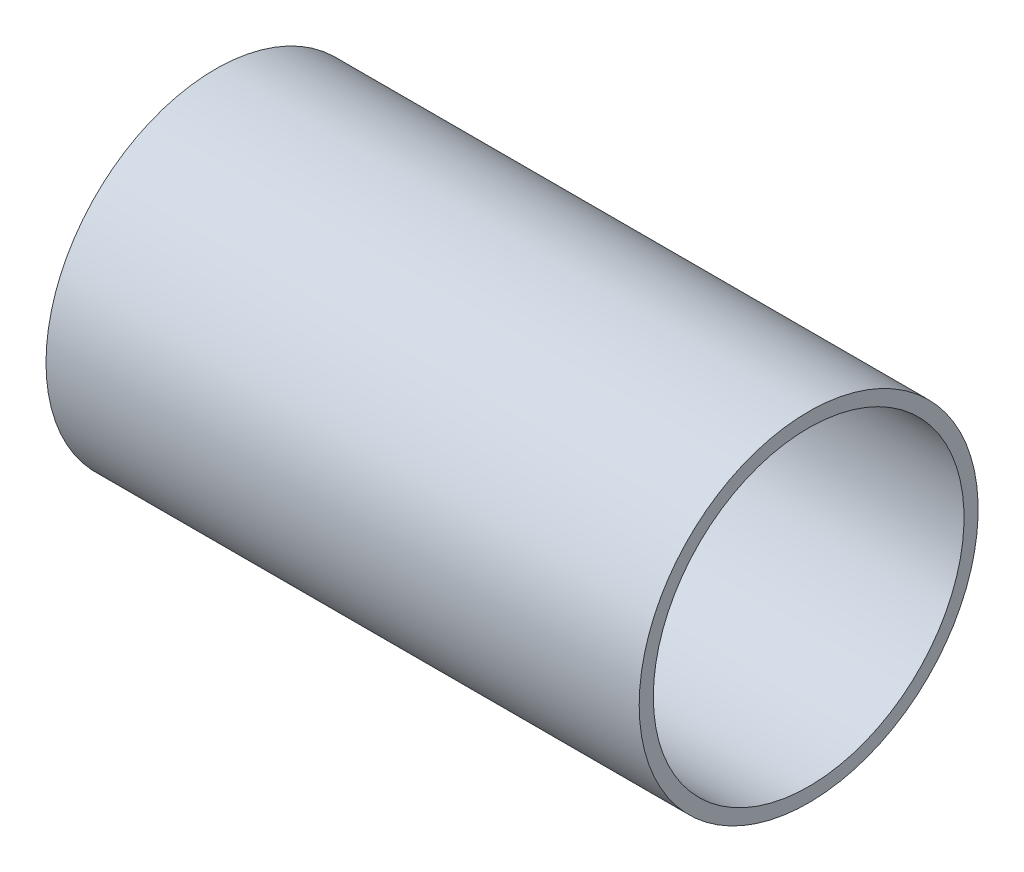
from build123d import *

# Parameters (mm, degrees)
SKETCH1_W = 42
SKETCH1_H = 1


with BuildPart() as part:
    # Sketch1 → Revolve1 (revolve)
    with BuildSketch(Plane.XY, mode=Mode.PRIVATE) as revolve1_sk:
        with Locations((21, 11.5)):
            Rectangle(SKETCH1_W, SKETCH1_H)
    revolve(revolve1_sk.sketch.rotate(Axis((0, 0, 0), (1, 0, 0)), 90), axis=Axis((0, 0, 0), (1, 0, 0)))


solid = part.part
